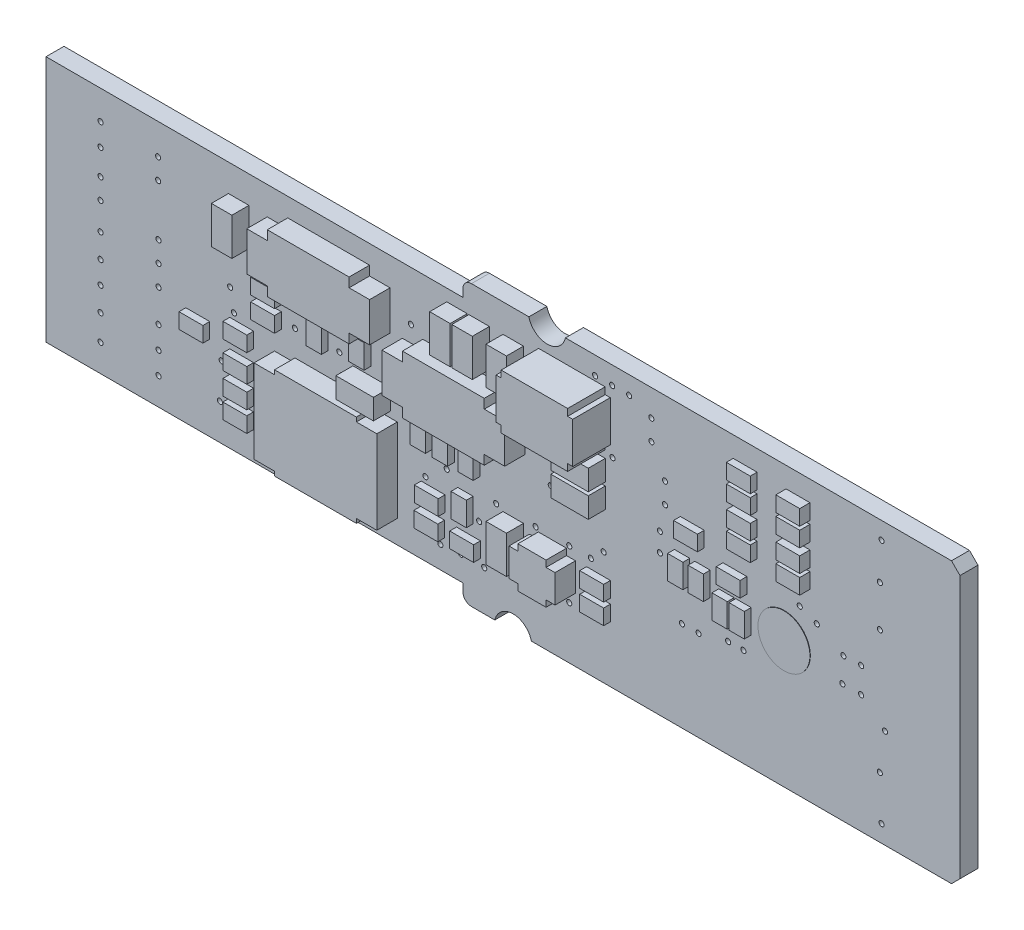
from build123d import *

# Parameters (mm, degrees)
BOARD_DEPTH         = 1.055
SKETCH2_R           = 0.15
PLATED_HOLES_DEPTH  = 56.792253271
SKETCH3_W           = 1.4
SKETCH3_H           = 0.9
R0201NAS_1_DEPTH    = 0.4
SKETCH4_W           = 1.4
SKETCH4_H           = 0.9
R0201NAS_2_DEPTH    = 0.4
SKETCH5_W           = 1.4
SKETCH5_H           = 0.9
R0201NAS_3_DEPTH    = 0.4
SKETCH6_W           = 1.4
SKETCH6_H           = 0.9
R0201NAS_4_DEPTH    = 0.4
SKETCH7_W           = 1.4
SKETCH7_H           = 0.9
R0201NAS_5_DEPTH    = 0.4
SKETCH8_W           = 1.4
SKETCH8_H           = 0.9
R0201NAS_6_DEPTH    = 0.4
SKETCH9_W           = 0.9
SKETCH9_H           = 1.4
R0201NAS_7_DEPTH    = 0.4
SKETCH10_W          = 0.9
SKETCH10_H          = 1.4
R0201NAS_8_DEPTH    = 0.4
SKETCH11_W          = 1.4
SKETCH11_H          = 0.9
R0201NAS_9_DEPTH    = 0.4
SKETCH12_W          = 1.4
SKETCH12_H          = 0.9
R0201NAS_10_DEPTH   = 0.4
SKETCH13_W          = 1.4
SKETCH13_H          = 0.9
R0201NAS_11_DEPTH   = 0.4
SKETCH14_W          = 0.9
SKETCH14_H          = 1.4
R0201NAS_12_DEPTH   = 0.4
SKETCH15_W          = 1.4
SKETCH15_H          = 0.9
R0201NAS_13_DEPTH   = 0.4
SKETCH16_W          = 0.9
SKETCH16_H          = 1.4
R0201NAS_14_DEPTH   = 0.4
SKETCH17_W          = 0.9
SKETCH17_H          = 1.4
R0201NAS_15_DEPTH   = 0.4
SKETCH18_W          = 1.4
SKETCH18_H          = 0.9
R0201NAS_16_DEPTH   = 0.4
SKETCH19_W          = 0.9
SKETCH19_H          = 1.4
R0201NAS_17_DEPTH   = 0.4
SKETCH20_W          = 1.4
SKETCH20_H          = 0.9
R0201NAS_18_DEPTH   = 0.4
SKETCH21_W          = 1.4
SKETCH21_H          = 0.9
R0201NAS_19_DEPTH   = 0.4
SKETCH22_W          = 0.9
SKETCH22_H          = 1.4
R0201NAS_20_DEPTH   = 0.4
SKETCH23_W          = 0.9
SKETCH23_H          = 1.4
R0201NAS_21_DEPTH   = 0.4
SKETCH24_W          = 1.4
SKETCH24_H          = 0.9
R0201NAS_22_DEPTH   = 0.4
SKETCH25_W          = 1.4
SKETCH25_H          = 0.9
R0201NAS_23_DEPTH   = 0.4
SKETCH26_W          = 1.4
SKETCH26_H          = 0.9
R0201NAS_24_DEPTH   = 0.4
SKETCH27_W          = 0.9
SKETCH27_H          = 1.4
R0201NAS_25_DEPTH   = 0.4
SKETCH28_W          = 1.4
SKETCH28_H          = 0.9
R0201NAS_26_DEPTH   = 0.4
SKETCH29_W          = 0.9
SKETCH29_H          = 1.4
R0201NAS_27_DEPTH   = 0.4
SKETCH30_W          = 1.4
SKETCH30_H          = 0.9
R0201NAS_28_DEPTH   = 0.4
SKETCH31_W          = 0.9
SKETCH31_H          = 1.4
R0201NAS_29_DEPTH   = 0.4
SKETCH32_W          = 1.4
SKETCH32_H          = 0.9
R0201NAS_30_DEPTH   = 0.4
SKETCH33_W          = 1.4
SKETCH33_H          = 0.9
R0201NAS_31_DEPTH   = 0.4
SKETCH34_W          = 1.4
SKETCH34_H          = 0.9
R0201NAS_32_DEPTH   = 0.4
SKETCH35_W          = 1.4
SKETCH35_H          = 0.9
R0201NAS_33_DEPTH   = 0.4
SKETCH36_W          = 1.4
SKETCH36_H          = 0.9
R0201NAS_34_DEPTH   = 0.4
SKETCH37_W          = 1.4
SKETCH37_H          = 0.9
R0201NAS_35_DEPTH   = 0.4
SKETCH38_W          = 1.4
SKETCH38_H          = 0.9
R0201NAS_36_DEPTH   = 0.4
SKETCH39_W          = 1.4
SKETCH39_H          = 0.9
R0201NAS_37_DEPTH   = 0.4
SKETCH40_W          = 0.9
SKETCH40_H          = 1.4
R0201NAS_38_DEPTH   = 0.4
SKETCH42_R          = 1.524
FIDGLOBAL_1_DEPTH   = 0.0254
SKETCH43_R          = 1.524
FIDGLOBAL_2_DEPTH   = 0.0254
SKETCH44_W          = 8.85
SKETCH44_H          = 4.1
R0203NAS_CE_1_DEPTH = 0.7
SKETCH45_W          = 8.85
SKETCH45_H          = 4.1
R0203NAS_CE_2_DEPTH = 0.7
SKETCH46_W          = 8.85
SKETCH46_H          = 4.1
R0203NAS_CE_3_DEPTH = 0.7
CE211NAS_1_DEPTH    = 2.2
SKETCH48_W          = 1.2
SKETCH48_H          = 2.2
C0204NAS_1_DEPTH    = 1
SKETCH49_W          = 1.2
SKETCH49_H          = 2.2
C0204NAS_2_DEPTH    = 1
SKETCH50_W          = 2.2
SKETCH50_H          = 1.2
C0204NAS_3_DEPTH    = 1
SKETCH51_W          = 1.2
SKETCH51_H          = 2.2
C0204NAS_4_DEPTH    = 1
SKETCH52_W          = 2.2
SKETCH52_H          = 1.2
C0204NAS_5_DEPTH    = 1
SKETCH53_W          = 1.2
SKETCH53_H          = 2.2
C0204NAS_6_DEPTH    = 1
SKETCH54_W          = 1.2
SKETCH54_H          = 2.2
C0204NAS_7_DEPTH    = 1
SKETCH55_W          = 2.2
SKETCH55_H          = 1.2
C0204NAS_8_DEPTH    = 1
SKETCH56_W          = 1.4
SKETCH56_H          = 0.9
C0215NAS_1_DEPTH    = 0.6
SKETCH57_W          = 1.4
SKETCH57_H          = 0.9
C0215NAS_2_DEPTH    = 0.6
SKETCH58_W          = 1.4
SKETCH58_H          = 0.9
C0215NAS_3_DEPTH    = 0.6
SKETCH59_W          = 1.4
SKETCH59_H          = 0.9
C0215NAS_4_DEPTH    = 0.6
SKETCH60_W          = 1.4
SKETCH60_H          = 0.9
C0215NAS_5_DEPTH    = 0.6
SKETCH61_W          = 1.4
SKETCH61_H          = 0.9
C0215NAS_6_DEPTH    = 0.6
SKETCH62_W          = 1.4
SKETCH62_H          = 0.9
C0215NAS_7_DEPTH    = 0.6
SKETCH63_W          = 1.4
SKETCH63_H          = 0.9
C0215NAS_8_DEPTH    = 0.6
Z0562NAS_1_DEPTH    = 1.2
Z0898NAS_1_DEPTH    = 1.2
Z0898NAS_2_DEPTH    = 1.2
Z0G58NAS_1_DEPTH    = 1.2


with BuildPart() as part:
    # Sketch1 → BOARD (new body)
    with BuildSketch(Plane.XY):
        with BuildLine():
            Line((24.45, 14.95), (24.45, 14.5))
            Line((24.45, 14.5), (2.3285, 14.5))
            Line((2.3285, 14.5), (0.2516, 14.5))
            Line((0.2516, 14.5), (0, 14.5))
            Line((0, 14.5), (0, 13.75))
            Line((0, 13.75), (0, 0.75))
            Line((0, 0.75), (0, 0))
            Line((0, 0), (0.2516, 0))
            Line((0.2516, 0), (2.3285, 0))
            Line((2.3285, 0), (24.45, 0))
            Line((24.45, 0), (24.45, -0.45))
            ThreePointArc((24.45, -0.45), (24.596455555, -0.803544445), (24.95, -0.95))
            Line((24.95, -0.95), (26.1285, -0.95))
            Line((26.1285, -0.95), (26.3188, -0.95))
            ThreePointArc((26.3188, -0.95), (27.39005, -0.099902191), (28.4613, -0.95))
            Line((28.4613, -0.95), (45.34, -0.95))
            Line((45.34, -0.95), (47.34, -0.95))
            Line((47.34, -0.95), (53.1, -0.95))
            Line((53.1, -0.95), (53.6, -0.45))
            Line((53.6, -0.45), (53.6, 14.95))
            Line((53.6, 14.95), (53.1, 15.45))
            Line((53.1, 15.45), (47.34, 15.45))
            Line((47.34, 15.45), (45.34, 15.45))
            Line((45.34, 15.45), (30.4613, 15.45))
            ThreePointArc((30.4613, 15.45), (29.39005, 14.599947896), (28.3188, 15.45))
            Line((28.3188, 15.45), (27.1285, 15.45))
            Line((27.1285, 15.45), (25.2516, 15.45))
            Line((25.2516, 15.45), (24.95, 15.45))
            ThreePointArc((24.95, 15.45), (24.596445331, 15.303554669), (24.45, 14.95))
        make_face()
    extrude(amount=BOARD_DEPTH)

    # Sketch2 → PLATED HOLES (cut, through all)
    with BuildSketch(Plane.XY):
        with Locations((31.95, 5)):
            Circle(SKETCH2_R)
        with Locations((38.2697, 4.3492)):
            Circle(SKETCH2_R)
        with Locations((37.2889, 4.3492)):
            Circle(SKETCH2_R)
        with Locations((21, 7.3)):
            Circle(SKETCH2_R)
        with Locations((26.4, 3.6)):
            Circle(SKETCH2_R)
        with Locations((10.3, 4.2)):
            Circle(SKETCH2_R)
        with Locations((11.025, 7)):
            Circle(SKETCH2_R)
        with Locations((12.1, 10.1)):
            Circle(SKETCH2_R)
        with Locations((22.9, 7.6)):
            Circle(SKETCH2_R)
        with Locations((16.1, 9.8)):
            Circle(SKETCH2_R)
        with Locations((29.6, 10.1)):
            Circle(SKETCH2_R)
        with Locations((29, 10.8)):
            Circle(SKETCH2_R)
        with Locations((25.4, 3.6)):
            Circle(SKETCH2_R)
        with Locations((10.8, 8.2)):
            Circle(SKETCH2_R)
        with Locations((47.8, 7.4841)):
            Circle(SKETCH2_R)
        with Locations((46.76, 7.46)):
            Circle(SKETCH2_R)
        with Locations((30.5, 7.5)):
            Circle(SKETCH2_R)
        with Locations((29.6, 7.5)):
            Circle(SKETCH2_R)
        with Locations((6.575, 11.5)):
            Circle(SKETCH2_R)
        with Locations((6.575, 12.7)):
            Circle(SKETCH2_R)
        with Locations((10.2, 2.1)):
            Circle(SKETCH2_R)
        with Locations((6.6, 4.2)):
            Circle(SKETCH2_R)
        with Locations((6.6, 2.9)):
            Circle(SKETCH2_R)
        with Locations((6.6, 1.6)):
            Circle(SKETCH2_R)
        with Locations((47.8, 6)):
            Circle(SKETCH2_R)
        with Locations((23, 11.927)):
            Circle(SKETCH2_R)
        with Locations((23, 11.1)):
            Circle(SKETCH2_R)
        with Locations((46.7, 6)):
            Circle(SKETCH2_R)
        with Locations((23.125, 1.3)):
            Circle(SKETCH2_R)
        with Locations((14.6, 9.25)):
            Circle(SKETCH2_R)
        with Locations((14.6, 8)):
            Circle(SKETCH2_R)
        with Locations((28.715, 4.985)):
            Circle(SKETCH2_R)
        with Locations((17.2, 8.1)):
            Circle(SKETCH2_R)
        with Locations((32.7, 5.7)):
            Circle(SKETCH2_R)
        with Locations((30.685, 2.115)):
            Circle(SKETCH2_R)
        with Locations((35.5, 13.9)):
            Circle(SKETCH2_R)
        with Locations((35.5, 12.7)):
            Circle(SKETCH2_R)
        with Locations((36.3, 11.1)):
            Circle(SKETCH2_R)
        with Locations((36.3, 9.9)):
            Circle(SKETCH2_R)
        with Locations((36, 7.3)):
            Circle(SKETCH2_R)
        with Locations((24.325, 1.4)):
            Circle(SKETCH2_R)
        with Locations((22.25, 4.3)):
            Circle(SKETCH2_R)
        with Locations((36, 8.4)):
            Circle(SKETCH2_R)
        with Locations((23.5, 5.3)):
            Circle(SKETCH2_R)
        with Locations((44.2, 8.7)):
            Circle(SKETCH2_R)
        with Locations((40.9, 4.8)):
            Circle(SKETCH2_R)
        with Locations((40, 4.8)):
            Circle(SKETCH2_R)
        with Locations((45.2, 8.3)):
            Circle(SKETCH2_R)
        with Locations((6.6, 8.5)):
            Circle(SKETCH2_R)
        with Locations((6.6, 7.3)):
            Circle(SKETCH2_R)
        with Locations((6.6, 6.1)):
            Circle(SKETCH2_R)
        with Locations((25.8, 7.1)):
            Circle(SKETCH2_R)
        with Locations((17.4, 7)):
            Circle(SKETCH2_R)
        with Locations((26.4, 5)):
            Circle(SKETCH2_R)
        with Locations((30.685, 5)):
            Circle(SKETCH2_R)
        with Locations((25.7, 1.4)):
            Circle(SKETCH2_R)
        with Locations((12.4, 1.2)):
            Circle(SKETCH2_R)
        with Locations((3.2, 12.8)):
            Circle(SKETCH2_R)
        with Locations((49, 0.05)):
            Circle(SKETCH2_R)
        with Locations((48.9, 2.6)):
            Circle(SKETCH2_R)
        with Locations((48.9, 9.85)):
            Circle(SKETCH2_R)
        with Locations((49.2, 4.85)):
            Circle(SKETCH2_R)
        with Locations((48.9, 12.25)):
            Circle(SKETCH2_R)
        with Locations((33.22, 10.75)):
            Circle(SKETCH2_R)
        with Locations((32.2, 14.4)):
            Circle(SKETCH2_R)
        with Locations((33.2, 14.4)):
            Circle(SKETCH2_R)
        with Locations((34.2, 14.4)):
            Circle(SKETCH2_R)
        with Locations((49, 14.4443)):
            Circle(SKETCH2_R)
        with Locations((3.2, 11.5)):
            Circle(SKETCH2_R)
        with Locations((3.2, 10)):
            Circle(SKETCH2_R)
        with Locations((3.2, 8.8)):
            Circle(SKETCH2_R)
        with Locations((3.2, 7.2)):
            Circle(SKETCH2_R)
        with Locations((3.2, 5.8)):
            Circle(SKETCH2_R)
        with Locations((3.2, 4.5)):
            Circle(SKETCH2_R)
        with Locations((3.2, 3.1)):
            Circle(SKETCH2_R)
        with Locations((3.2, 1.6)):
            Circle(SKETCH2_R)
        with Locations((21.4, 11.6)):
            Circle(SKETCH2_R)
    extrude(amount=PLATED_HOLES_DEPTH, mode=Mode.SUBTRACT)


with BuildPart() as body_2:
    # Sketch3 → R0201NAS-1 (new body)
    with BuildSketch(Plane.XY.offset(1.055)):
        with Locations((41, 10.3)):
            Rectangle(SKETCH3_W, SKETCH3_H)
    extrude(amount=R0201NAS_1_DEPTH)


with BuildPart() as body_3:
    # Sketch4 → R0201NAS-2 (new body)
    with BuildSketch(Plane.XY.offset(1.055)):
        with Locations((24.775, 2.2)):
            Rectangle(SKETCH4_W, SKETCH4_H)
    extrude(amount=R0201NAS_2_DEPTH)


with BuildPart() as body_4:
    # Sketch5 → R0201NAS-3 (new body)
    with BuildSketch(Plane.XY.offset(1.055)):
        with Locations((22.675, 2.2)):
            Rectangle(SKETCH5_W, SKETCH5_H)
    extrude(amount=R0201NAS_3_DEPTH)


with BuildPart() as body_5:
    # Sketch6 → R0201NAS-4 (new body)
    with BuildSketch(Plane.XY.offset(1.055)):
        with Locations((8.9, 5.4)):
            Rectangle(SKETCH6_W, SKETCH6_H)
    extrude(amount=R0201NAS_4_DEPTH)


with BuildPart() as body_6:
    # Sketch7 → R0201NAS-5 (new body)
    with BuildSketch(Plane.XY.offset(1.055)):
        with Locations((11.475, 2.1)):
            Rectangle(SKETCH7_W, SKETCH7_H)
    extrude(amount=R0201NAS_5_DEPTH)


with BuildPart() as body_7:
    # Sketch8 → R0201NAS-6 (new body)
    with BuildSketch(Plane.XY.offset(1.055)):
        with Locations((11.475, 3.3)):
            Rectangle(SKETCH8_W, SKETCH8_H)
    extrude(amount=R0201NAS_6_DEPTH)


with BuildPart() as body_8:
    # Sketch9 → R0201NAS-7 (new body)
    with BuildSketch(Plane.XY.offset(1.055)):
        with Locations((25, 6.6)):
            Rectangle(SKETCH9_W, SKETCH9_H)
    extrude(amount=R0201NAS_7_DEPTH)


with BuildPart() as body_9:
    # Sketch10 → R0201NAS-8 (new body)
    with BuildSketch(Plane.XY.offset(1.055)):
        with Locations((22.2, 6.575)):
            Rectangle(SKETCH10_W, SKETCH10_H)
    extrude(amount=R0201NAS_8_DEPTH)


with BuildPart() as body_10:
    # Sketch11 → R0201NAS-9 (new body)
    with BuildSketch(Plane.XY.offset(1.055)):
        with Locations((11.475, 6.2)):
            Rectangle(SKETCH11_W, SKETCH11_H)
    extrude(amount=R0201NAS_9_DEPTH)


with BuildPart() as body_11:
    # Sketch12 → R0201NAS-10 (new body)
    with BuildSketch(Plane.XY.offset(1.055)):
        with Locations((11.475, 4.6)):
            Rectangle(SKETCH12_W, SKETCH12_H)
    extrude(amount=R0201NAS_10_DEPTH)


with BuildPart() as body_12:
    # Sketch13 → R0201NAS-11 (new body)
    with BuildSketch(Plane.XY.offset(1.055)):
        with Locations((13.1, 9.25)):
            Rectangle(SKETCH13_W, SKETCH13_H)
    extrude(amount=R0201NAS_11_DEPTH)


with BuildPart() as body_13:
    # Sketch14 → R0201NAS-12 (new body)
    with BuildSketch(Plane.XY.offset(1.055)):
        with Locations((18.6, 9)):
            Rectangle(SKETCH14_W, SKETCH14_H)
    extrude(amount=R0201NAS_12_DEPTH)


with BuildPart() as body_14:
    # Sketch15 → R0201NAS-13 (new body)
    with BuildSketch(Plane.XY.offset(1.055)):
        with Locations((22.7, 3.5)):
            Rectangle(SKETCH15_W, SKETCH15_H)
    extrude(amount=R0201NAS_13_DEPTH)


with BuildPart() as body_15:
    # Sketch16 → R0201NAS-14 (new body)
    with BuildSketch(Plane.XY.offset(1.055)):
        with Locations((24.6, 4)):
            Rectangle(SKETCH16_W, SKETCH16_H)
    extrude(amount=R0201NAS_14_DEPTH)


with BuildPart() as body_16:
    # Sketch17 → R0201NAS-15 (new body)
    with BuildSketch(Plane.XY.offset(1.055)):
        with Locations((23.5, 6.575)):
            Rectangle(SKETCH17_W, SKETCH17_H)
    extrude(amount=R0201NAS_15_DEPTH)


with BuildPart() as body_17:
    # Sketch18 → R0201NAS-16 (new body)
    with BuildSketch(Plane.XY.offset(1.055)):
        with Locations((13.1, 8)):
            Rectangle(SKETCH18_W, SKETCH18_H)
    extrude(amount=R0201NAS_16_DEPTH)


with BuildPart() as body_18:
    # Sketch19 → R0201NAS-17 (new body)
    with BuildSketch(Plane.XY.offset(1.055)):
        with Locations((16.1, 8.55)):
            Rectangle(SKETCH19_W, SKETCH19_H)
    extrude(amount=R0201NAS_17_DEPTH)


with BuildPart() as body_19:
    # Sketch20 → R0201NAS-18 (new body)
    with BuildSketch(Plane.XY.offset(1.055)):
        with Locations((32.4, 2.8)):
            Rectangle(SKETCH20_W, SKETCH20_H)
    extrude(amount=R0201NAS_18_DEPTH)


with BuildPart() as body_20:
    # Sketch21 → R0201NAS-19 (new body)
    with BuildSketch(Plane.XY.offset(1.055)):
        with Locations((32.4, 4)):
            Rectangle(SKETCH21_W, SKETCH21_H)
    extrude(amount=R0201NAS_19_DEPTH)


with BuildPart() as body_21:
    # Sketch22 → R0201NAS-20 (new body)
    with BuildSketch(Plane.XY):
        with Locations((39.7, 10.5)):
            Rectangle(SKETCH22_W, SKETCH22_H)
    extrude(amount=-R0201NAS_20_DEPTH)


with BuildPart() as body_22:
    # Sketch23 → R0201NAS-21 (new body)
    with BuildSketch(Plane.XY):
        with Locations((39.7, 13.3)):
            Rectangle(SKETCH23_W, SKETCH23_H)
    extrude(amount=-R0201NAS_21_DEPTH)


with BuildPart() as body_23:
    # Sketch24 → R0201NAS-22 (new body)
    with BuildSketch(Plane.XY.offset(1.055)):
        with Locations((40.4, 8.2)):
            Rectangle(SKETCH24_W, SKETCH24_H)
    extrude(amount=R0201NAS_22_DEPTH)


with BuildPart() as body_24:
    # Sketch25 → R0201NAS-23 (new body)
    with BuildSketch(Plane.XY.offset(1.055)):
        with Locations((37.9, 9.3)):
            Rectangle(SKETCH25_W, SKETCH25_H)
    extrude(amount=R0201NAS_23_DEPTH)


with BuildPart() as body_25:
    # Sketch26 → R0201NAS-24 (new body)
    with BuildSketch(Plane.XY):
        with Locations((41.7, 13.8)):
            Rectangle(SKETCH26_W, SKETCH26_H)
    extrude(amount=-R0201NAS_24_DEPTH)


with BuildPart() as body_26:
    # Sketch27 → R0201NAS-25 (new body)
    with BuildSketch(Plane.XY.offset(1.055)):
        with Locations((40.9, 6.5)):
            Rectangle(SKETCH27_W, SKETCH27_H)
    extrude(amount=R0201NAS_25_DEPTH)


with BuildPart() as body_27:
    # Sketch28 → R0201NAS-26 (new body)
    with BuildSketch(Plane.XY.offset(1.055)):
        with Locations((41, 11.4)):
            Rectangle(SKETCH28_W, SKETCH28_H)
    extrude(amount=R0201NAS_26_DEPTH)


with BuildPart() as body_28:
    # Sketch29 → R0201NAS-27 (new body)
    with BuildSketch(Plane.XY.offset(1.055)):
        with Locations((39.9, 6.5)):
            Rectangle(SKETCH29_W, SKETCH29_H)
    extrude(amount=R0201NAS_27_DEPTH)


with BuildPart() as body_29:
    # Sketch30 → R0201NAS-28 (new body)
    with BuildSketch(Plane.XY.offset(1.055)):
        with Locations((41, 12.7)):
            Rectangle(SKETCH30_W, SKETCH30_H)
    extrude(amount=R0201NAS_28_DEPTH)


with BuildPart() as body_30:
    # Sketch31 → R0201NAS-29 (new body)
    with BuildSketch(Plane.XY.offset(1.055)):
        with Locations((38.5, 7.2)):
            Rectangle(SKETCH31_W, SKETCH31_H)
    extrude(amount=R0201NAS_29_DEPTH)


with BuildPart() as body_31:
    # Sketch32 → R0201NAS-30 (new body)
    with BuildSketch(Plane.XY.offset(1.055)):
        with Locations((41, 13.8)):
            Rectangle(SKETCH32_W, SKETCH32_H)
    extrude(amount=R0201NAS_30_DEPTH)


with BuildPart() as body_32:
    # Sketch33 → R0201NAS-31 (new body)
    with BuildSketch(Plane.XY):
        with Locations((38, 10)):
            Rectangle(SKETCH33_W, SKETCH33_H)
    extrude(amount=-R0201NAS_31_DEPTH)


with BuildPart() as body_33:
    # Sketch34 → R0201NAS-32 (new body)
    with BuildSketch(Plane.XY):
        with Locations((41.7, 9.9)):
            Rectangle(SKETCH34_W, SKETCH34_H)
    extrude(amount=-R0201NAS_32_DEPTH)


with BuildPart() as body_34:
    # Sketch35 → R0201NAS-33 (new body)
    with BuildSketch(Plane.XY):
        with Locations((38, 11)):
            Rectangle(SKETCH35_W, SKETCH35_H)
    extrude(amount=-R0201NAS_33_DEPTH)


with BuildPart() as body_35:
    # Sketch36 → R0201NAS-34 (new body)
    with BuildSketch(Plane.XY):
        with Locations((41.7, 11)):
            Rectangle(SKETCH36_W, SKETCH36_H)
    extrude(amount=-R0201NAS_34_DEPTH)


with BuildPart() as body_36:
    # Sketch37 → R0201NAS-35 (new body)
    with BuildSketch(Plane.XY):
        with Locations((38, 12.7)):
            Rectangle(SKETCH37_W, SKETCH37_H)
    extrude(amount=-R0201NAS_35_DEPTH)


with BuildPart() as body_37:
    # Sketch38 → R0201NAS-36 (new body)
    with BuildSketch(Plane.XY):
        with Locations((41.7, 12.7)):
            Rectangle(SKETCH38_W, SKETCH38_H)
    extrude(amount=-R0201NAS_36_DEPTH)


with BuildPart() as body_38:
    # Sketch39 → R0201NAS-37 (new body)
    with BuildSketch(Plane.XY):
        with Locations((38, 13.8)):
            Rectangle(SKETCH39_W, SKETCH39_H)
    extrude(amount=-R0201NAS_37_DEPTH)


with BuildPart() as body_39:
    # Sketch40 → R0201NAS-38 (new body)
    with BuildSketch(Plane.XY.offset(1.055)):
        with Locations((37.3, 7.2)):
            Rectangle(SKETCH40_W, SKETCH40_H)
    extrude(amount=R0201NAS_38_DEPTH)


with BuildPart() as body_40:
    # Sketch42 → FIDGLOBAL-1 (new body)
    with BuildSketch(Plane.XY):
        with Locations((35, 3.8)):
            Circle(SKETCH42_R)
    extrude(amount=-FIDGLOBAL_1_DEPTH)


with BuildPart() as body_41:
    # Sketch43 → FIDGLOBAL-2 (new body)
    with BuildSketch(Plane.XY.offset(1.055)):
        with Locations((43.3, 6.5)):
            Circle(SKETCH43_R)
    extrude(amount=FIDGLOBAL_2_DEPTH)


with BuildPart() as body_42:
    # Sketch44 → R0203NAS_CE-1 (new body)
    with BuildSketch(Plane.XY):
        with Locations((4.9, 7.25)):
            Rectangle(SKETCH44_W, SKETCH44_H)
    extrude(amount=-R0203NAS_CE_1_DEPTH)


with BuildPart() as body_43:
    # Sketch45 → R0203NAS_CE-2 (new body)
    with BuildSketch(Plane.XY):
        with Locations((4.875, 11.45)):
            Rectangle(SKETCH45_W, SKETCH45_H)
    extrude(amount=-R0203NAS_CE_2_DEPTH)


with BuildPart() as body_44:
    # Sketch46 → R0203NAS_CE-3 (new body)
    with BuildSketch(Plane.XY):
        with Locations((4.875, 3.05)):
            Rectangle(SKETCH46_W, SKETCH46_H)
    extrude(amount=-R0203NAS_CE_3_DEPTH)


with BuildPart() as body_45:
    # Sketch47 → CE211NAS-1 (new body)
    with BuildSketch(Plane.XY.offset(1.055)):
        Polygon((28.59, 13.73), (28.59, 11.33), (28.89, 11.33), (28.89, 10.93), (32.79, 10.93), (32.79, 11.33), (33.09, 11.33), (33.09, 13.73), (32.79, 13.73), (32.79, 14.13), (28.89, 14.13), (28.89, 13.73), align=None)
    extrude(amount=CE211NAS_1_DEPTH)


with BuildPart() as body_46:
    # Sketch48 → C0204NAS-1 (new body)
    with BuildSketch(Plane.XY.offset(1.055)):
        with Locations((27.4, 12.7)):
            Rectangle(SKETCH48_W, SKETCH48_H)
    extrude(amount=C0204NAS_1_DEPTH)


with BuildPart() as body_47:
    # Sketch49 → C0204NAS-2 (new body)
    with BuildSketch(Plane.XY.offset(1.055)):
        with Locations((27.4, 3.7)):
            Rectangle(SKETCH49_W, SKETCH49_H)
    extrude(amount=C0204NAS_2_DEPTH)


with BuildPart() as body_48:
    # Sketch50 → C0204NAS-3 (new body)
    with BuildSketch(Plane.XY.offset(1.055)):
        with Locations((31.7, 8.5)):
            Rectangle(SKETCH50_W, SKETCH50_H)
    extrude(amount=C0204NAS_3_DEPTH)


with BuildPart() as body_49:
    # Sketch51 → C0204NAS-4 (new body)
    with BuildSketch(Plane.XY.offset(1.055)):
        with Locations((24.1, 12.7)):
            Rectangle(SKETCH51_W, SKETCH51_H)
    extrude(amount=C0204NAS_4_DEPTH)


with BuildPart() as body_50:
    # Sketch52 → C0204NAS-5 (new body)
    with BuildSketch(Plane.XY.offset(1.055)):
        with Locations((19.1, 7.2)):
            Rectangle(SKETCH52_W, SKETCH52_H)
    extrude(amount=C0204NAS_5_DEPTH)


with BuildPart() as body_51:
    # Sketch53 → C0204NAS-6 (new body)
    with BuildSketch(Plane.XY.offset(1.055)):
        with Locations((11.3, 11.8)):
            Rectangle(SKETCH53_W, SKETCH53_H)
    extrude(amount=C0204NAS_6_DEPTH)


with BuildPart() as body_52:
    # Sketch54 → C0204NAS-7 (new body)
    with BuildSketch(Plane.XY.offset(1.055)):
        with Locations((25.4, 12.7)):
            Rectangle(SKETCH54_W, SKETCH54_H)
    extrude(amount=C0204NAS_7_DEPTH)


with BuildPart() as body_53:
    # Sketch55 → C0204NAS-8 (new body)
    with BuildSketch(Plane.XY.offset(1.055)):
        with Locations((31.7, 9.9)):
            Rectangle(SKETCH55_W, SKETCH55_H)
    extrude(amount=C0204NAS_8_DEPTH)


with BuildPart() as body_54:
    # Sketch56 → C0215NAS-1 (new body)
    with BuildSketch(Plane.XY.offset(1.055)):
        with Locations((44.1, 13.8)):
            Rectangle(SKETCH56_W, SKETCH56_H)
    extrude(amount=C0215NAS_1_DEPTH)


with BuildPart() as body_55:
    # Sketch57 → C0215NAS-2 (new body)
    with BuildSketch(Plane.XY.offset(1.055)):
        with Locations((44.1, 12.7)):
            Rectangle(SKETCH57_W, SKETCH57_H)
    extrude(amount=C0215NAS_2_DEPTH)


with BuildPart() as body_56:
    # Sketch58 → C0215NAS-3 (new body)
    with BuildSketch(Plane.XY.offset(1.055)):
        with Locations((44.1, 11.4)):
            Rectangle(SKETCH58_W, SKETCH58_H)
    extrude(amount=C0215NAS_3_DEPTH)


with BuildPart() as body_57:
    # Sketch59 → C0215NAS-4 (new body)
    with BuildSketch(Plane.XY.offset(1.055)):
        with Locations((44.1, 10.3)):
            Rectangle(SKETCH59_W, SKETCH59_H)
    extrude(amount=C0215NAS_4_DEPTH)


with BuildPart() as body_58:
    # Sketch60 → C0215NAS-5 (new body)
    with BuildSketch(Plane.XY):
        with Locations((44.1, 9.9)):
            Rectangle(SKETCH60_W, SKETCH60_H)
    extrude(amount=-C0215NAS_5_DEPTH)


with BuildPart() as body_59:
    # Sketch61 → C0215NAS-6 (new body)
    with BuildSketch(Plane.XY):
        with Locations((44.1, 11)):
            Rectangle(SKETCH61_W, SKETCH61_H)
    extrude(amount=-C0215NAS_6_DEPTH)


with BuildPart() as body_60:
    # Sketch62 → C0215NAS-7 (new body)
    with BuildSketch(Plane.XY):
        with Locations((44.1, 12.7)):
            Rectangle(SKETCH62_W, SKETCH62_H)
    extrude(amount=-C0215NAS_7_DEPTH)


with BuildPart() as body_61:
    # Sketch63 → C0215NAS-8 (new body)
    with BuildSketch(Plane.XY):
        with Locations((44.1, 13.8)):
            Rectangle(SKETCH63_W, SKETCH63_H)
    extrude(amount=-C0215NAS_8_DEPTH)


with BuildPart() as body_62:
    # Sketch64 → Z0562NAS-1 (new body)
    with BuildSketch(Plane.XY.offset(1.055)):
        Polygon((28.35, 2.775), (28.875, 2.775), (28.875, 2.4), (30.525, 2.4), (30.525, 2.775), (31.05, 2.775), (31.05, 4.425), (30.525, 4.425), (30.525, 4.8), (28.875, 4.8), (28.875, 4.425), (28.35, 4.425), align=None)
    extrude(amount=Z0562NAS_1_DEPTH)


with BuildPart() as body_63:
    # Sketch65 → Z0898NAS-1 (new body)
    with BuildSketch(Plane.XY.offset(1.055)):
        Polygon((20.9, 10.65), (22.1, 10.65), (22.1, 11.2), (26.9, 11.2), (26.9, 10.65), (28.1, 10.65), (28.1, 8.35), (26.9, 8.35), (26.9, 7.8), (22.1, 7.8), (22.1, 8.35), (20.9, 8.35), align=None)
    extrude(amount=Z0898NAS_1_DEPTH)


with BuildPart() as body_64:
    # Sketch66 → Z0898NAS-2 (new body)
    with BuildSketch(Plane.XY.offset(1.055)):
        Polygon((20.175, 10.55), (18.975, 10.55), (18.975, 10), (14.175, 10), (14.175, 10.55), (12.975, 10.55), (12.975, 12.85), (14.175, 12.85), (14.175, 13.4), (18.975, 13.4), (18.975, 12.85), (20.175, 12.85), align=None)
    extrude(amount=Z0898NAS_2_DEPTH)


with BuildPart() as body_65:
    # Sketch67 → Z0G58NAS-1 (new body)
    with BuildSketch(Plane.XY.offset(1.055)):
        Polygon((19.4, 6.5), (14.6, 6.5), (14.6, 6.25), (13.4, 6.25), (13.4, 1.35), (14.6, 1.35), (14.6, 1.1), (19.4, 1.1), (19.4, 1.35), (20.6, 1.35), (20.6, 6.25), (19.4, 6.25), align=None)
    extrude(amount=Z0G58NAS_1_DEPTH)


solid = Compound([part.part, body_2.part, body_3.part, body_4.part, body_5.part, body_6.part, body_7.part, body_8.part, body_9.part, body_10.part, body_11.part, body_12.part, body_13.part, body_14.part, body_15.part, body_16.part, body_17.part, body_18.part, body_19.part, body_20.part, body_21.part, body_22.part, body_23.part, body_24.part, body_25.part, body_26.part, body_27.part, body_28.part, body_29.part, body_30.part, body_31.part, body_32.part, body_33.part, body_34.part, body_35.part, body_36.part, body_37.part, body_38.part, body_39.part, body_40.part, body_41.part, body_42.part, body_43.part, body_44.part, body_45.part, body_46.part, body_47.part, body_48.part, body_49.part, body_50.part, body_51.part, body_52.part, body_53.part, body_54.part, body_55.part, body_56.part, body_57.part, body_58.part, body_59.part, body_60.part, body_61.part, body_62.part, body_63.part, body_64.part, body_65.part])
